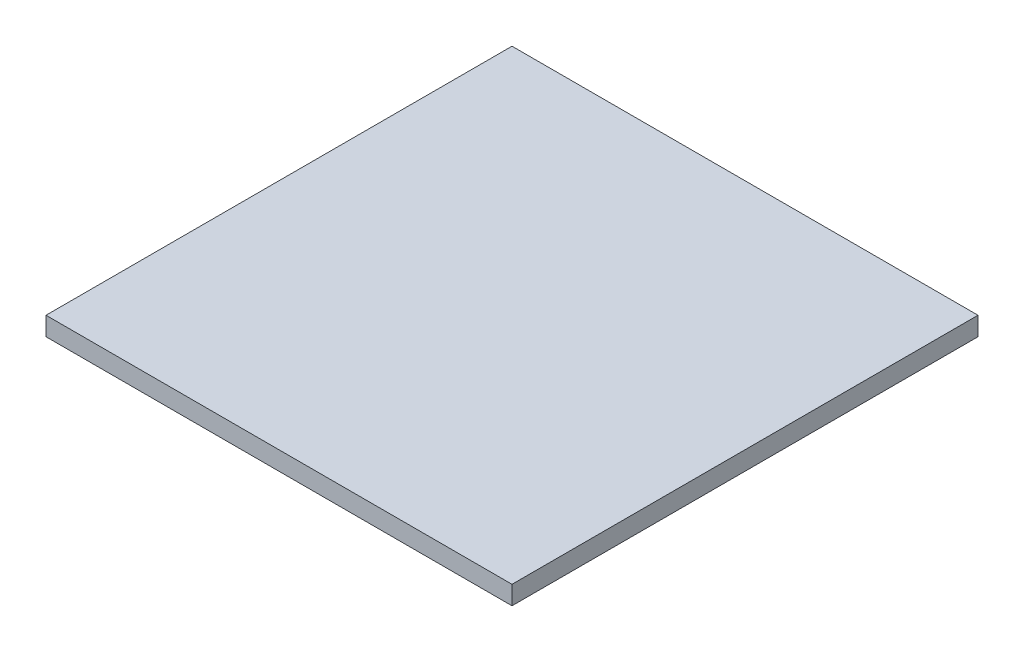
from build123d import *

# Parameters (mm, degrees)
SKETCH8_W           = 150
SKETCH8_H           = 150
BOSS_EXTRUDE2_DEPTH = 6


with BuildPart() as part:
    # Sketch8 → Boss-Extrude2 (new body)
    with BuildSketch(Plane(origin=(0, 0, 0), x_dir=(1, 0, 0), z_dir=(0, 1, 0))):
        with Locations((75, 75)):
            Rectangle(SKETCH8_W, SKETCH8_H)
    extrude(amount=BOSS_EXTRUDE2_DEPTH)


solid = part.part
